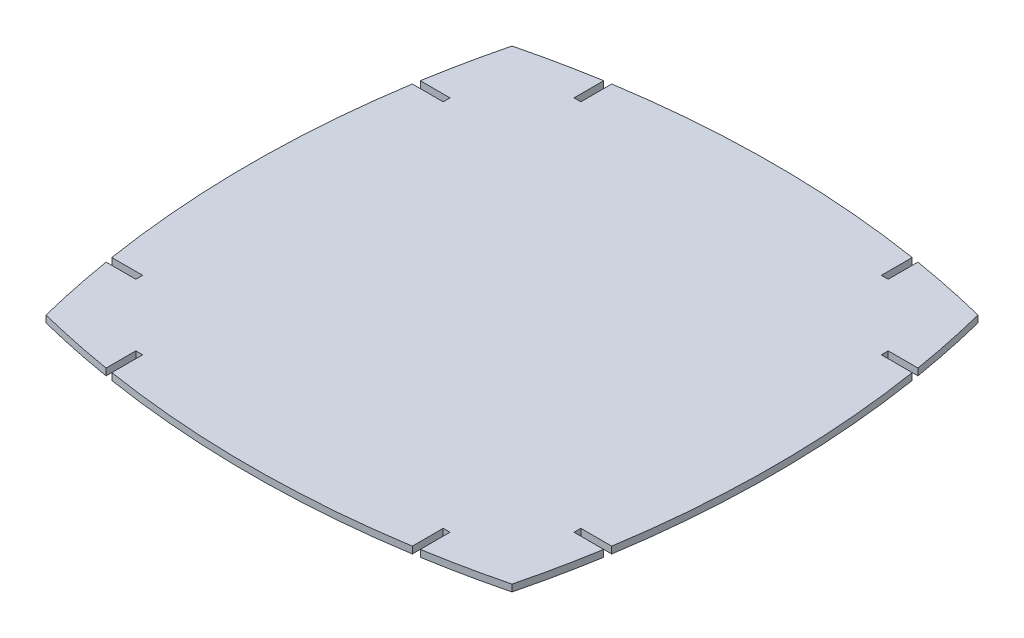
from build123d import *

# Parameters (mm, degrees)
BOSS_EXTRUDE1_DEPTH = 5


with BuildPart() as part:
    # Sketch1 → Boss-Extrude1 (new body)
    with BuildSketch(Plane(origin=(0, 0, 0), x_dir=(1, 0, 0), z_dir=(0, 1, 0))):
        with BuildLine():
            Line((115, 160.4), (110, 160.4))
            Line((110, 160.4), (110, 182.966371269))
            ThreePointArc((110, 182.966371269), (0, 191.663253961), (-110, 182.966371269))
            Line((-110, 182.966371269), (-110, 160.4))
            Line((-110, 160.4), (-115, 160.4))
            Line((-115, 160.4), (-115, 182.15221115))
            ThreePointArc((-115, 182.15221115), (-142.899993603, 176.922031233), (-170.565, 170.565))
            ThreePointArc((-170.565, 170.565), (-176.922031233, 142.899993603), (-182.15221115, 115))
            Line((-182.15221115, 115), (-160.4, 115))
            Line((-160.4, 115), (-160.4, 110))
            Line((-160.4, 110), (-182.966371269, 110))
            ThreePointArc((-182.966371269, 110), (-191.663253961, 0), (-182.966371269, -110))
            Line((-182.966371269, -110), (-160.4, -110))
            Line((-160.4, -110), (-160.4, -115))
            Line((-160.4, -115), (-182.15221115, -115))
            ThreePointArc((-182.15221115, -115), (-176.922031233, -142.899993603), (-170.565, -170.565))
            ThreePointArc((-170.565, -170.565), (-142.899993603, -176.922031233), (-115, -182.15221115))
            Line((-115, -182.15221115), (-115, -160.4))
            Line((-115, -160.4), (-110, -160.4))
            Line((-110, -160.4), (-110, -182.966371269))
            ThreePointArc((-110, -182.966371269), (0, -191.663253961), (110, -182.966371269))
            Line((110, -182.966371269), (110, -160.4))
            Line((110, -160.4), (115, -160.4))
            Line((115, -160.4), (115, -182.15221115))
            ThreePointArc((115, -182.15221115), (142.899993603, -176.922031233), (170.565, -170.565))
            ThreePointArc((170.565, -170.565), (176.922031233, -142.899993603), (182.15221115, -115))
            Line((182.15221115, -115), (160.4, -115))
            Line((160.4, -115), (160.4, -110))
            Line((160.4, -110), (182.966371269, -110))
            ThreePointArc((182.966371269, -110), (191.663253961, 0), (182.966371269, 110))
            Line((182.966371269, 110), (160.4, 110))
            Line((160.4, 110), (160.4, 115))
            Line((160.4, 115), (182.15221115, 115))
            ThreePointArc((182.15221115, 115), (176.922031233, 142.899993603), (170.565, 170.565))
            ThreePointArc((170.565, 170.565), (142.899993603, 176.922031233), (115, 182.15221115))
            Line((115, 182.15221115), (115, 160.4))
        make_face()
    extrude(amount=BOSS_EXTRUDE1_DEPTH)


solid = part.part
